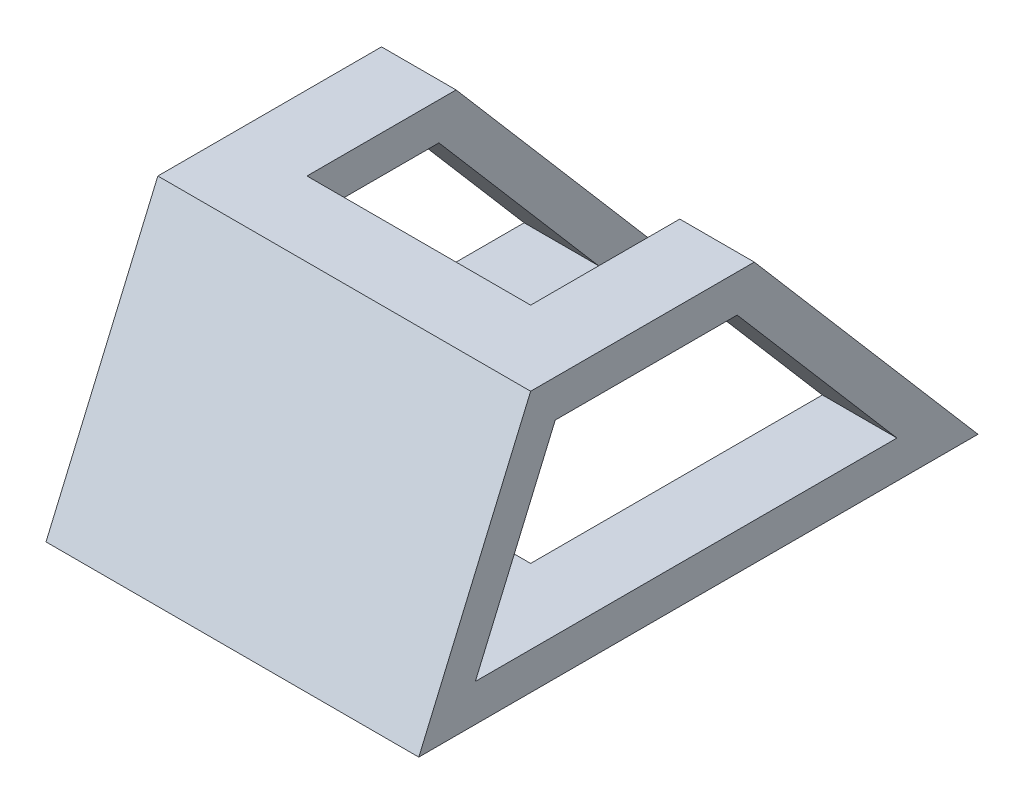
from build123d import *

# Parameters (mm, degrees)
Y_KSEKLIK_EKSTR_ZYON1_DEPTH = 100
IZIM2_W                     = 60
IZIM2_H                     = 100
KES_EKSTR_ZYON1_DEPTH       = 100


with BuildPart() as part:
    # Çizim1 → Yükseklik-Ekstrüzyon1 (new body)
    with BuildSketch(Plane(origin=(0, 0, 0), x_dir=(0, 0, -1), z_dir=(1, 0, 0))):
        Polygon((-50.577777778, 44.644444444), (-80.577777778, -25.355555556), (69.422222222, -25.355555556), (9.422222222, 44.644444444), align=None)
        Polygon((-43.983816198, 34.644444444), (-65.412387627, -15.355555556), (47.680015855, -15.355555556), (4.822872998, 34.644444444), align=None, mode=Mode.SUBTRACT)
    extrude(amount=Y_KSEKLIK_EKSTR_ZYON1_DEPTH)

    # Çizim2 → Kes-Ekstrüzyon1 (cut)
    with BuildSketch(Plane(origin=(0, 44.644444444, 0), x_dir=(1, 0, 0), z_dir=(0, 1, 0))):
        with Locations((50, 19.422222222)):
            Rectangle(IZIM2_W, IZIM2_H)
    extrude(amount=-KES_EKSTR_ZYON1_DEPTH, mode=Mode.SUBTRACT)


solid = part.part
